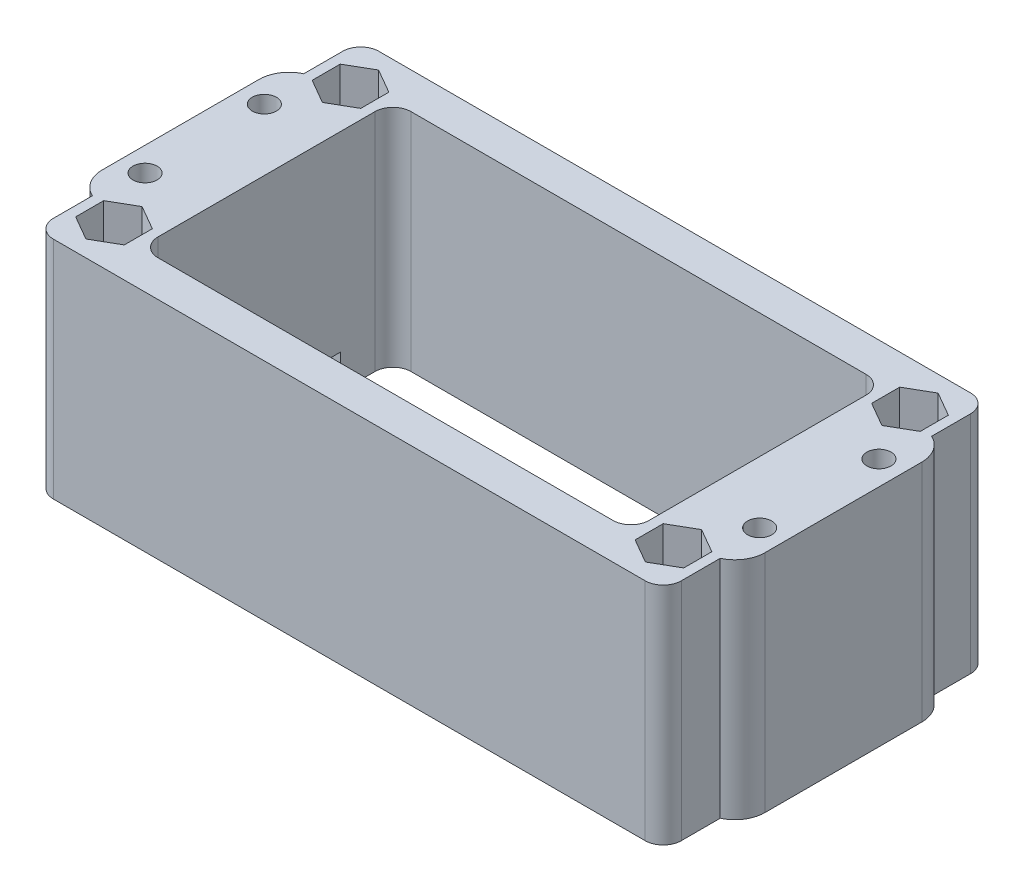
from build123d import *

# Parameters (mm, degrees)
SALIENTE_EXTRUIR1_DEPTH = 18.68
SALIENTE_EXTRUIR2_DEPTH = 18.68
CROQUIS3_W              = 12.25
CROQUIS3_H              = 2.83
CORTAR_EXTRUIR1_DEPTH   = 59.051339796
CROQUIS4_R              = 1.175
CORTAR_EXTRUIR2_DEPTH   = 63.813572819
CORTAR_EXTRUIR3_DEPTH   = 14.68
CROQUIS6_R              = 1
CORTAR_EXTRUIR4_DEPTH   = 5


with BuildPart() as part:
    # Croquis1 → Saliente-Extruir1 (new body)
    with BuildSketch(Plane(origin=(0, 0, 0), x_dir=(1, 0, 0), z_dir=(0, 1, 0))):
        with BuildLine():
            Line((1.5, 0), (50.6, 0))
            ThreePointArc((50.6, 0), (51.660660172, 0.439339828), (52.1, 1.5))
            Line((52.1, 1.5), (52.1, 25.5))
            ThreePointArc((52.1, 25.5), (51.660660172, 26.560660172), (50.6, 27))
            Line((50.6, 27), (1.5, 27))
            ThreePointArc((1.5, 27), (0.439339828, 26.560660172), (0, 25.5))
            Line((0, 25.5), (0, 1.5))
            ThreePointArc((0, 1.5), (0.439339828, 0.439339828), (1.5, 0))
        make_face()
        with BuildLine():
            Line((7.175, 24), (44.925, 24))
            ThreePointArc((44.925, 24), (45.985660172, 23.560660172), (46.425, 22.5))
            Line((46.425, 22.5), (46.425, 4.5))
            ThreePointArc((46.425, 4.5), (45.985660172, 3.439339828), (44.925, 3))
            Line((44.925, 3), (7.175, 3))
            ThreePointArc((7.175, 3), (6.114339828, 3.439339828), (5.675, 4.5))
            Line((5.675, 4.5), (5.675, 22.5))
            ThreePointArc((5.675, 22.5), (6.114339828, 23.560660172), (7.175, 24))
        make_face(mode=Mode.SUBTRACT)
    extrude(amount=SALIENTE_EXTRUIR1_DEPTH)

    # Croquis2 → Saliente-Extruir2 (add)
    with BuildSketch(Plane(origin=(0, 18.68, 0), x_dir=(1, 0, 0), z_dir=(0, 1, 0))):
        with BuildLine():
            Line((0, 22.27), (0, 4.73))
            ThreePointArc((0, 4.73), (-1.056857895, 5.653020288), (-1.45, 7))
            Line((-1.45, 7), (-1.45, 20))
            ThreePointArc((-1.45, 20), (-1.056857895, 21.346979712), (0, 22.27))
        make_face()
        with BuildLine():
            Line((53.55, 20), (53.55, 7))
            ThreePointArc((53.55, 7), (53.156857895, 5.653020288), (52.1, 4.73))
            Line((52.1, 4.73), (52.1, 22.27))
            ThreePointArc((52.1, 22.27), (53.156857895, 21.346979712), (53.55, 20))
        make_face()
    extrude(amount=-SALIENTE_EXTRUIR2_DEPTH)

    # Croquis3 → Cortar-Extruir1 (cut, through all)
    with BuildSketch(Plane(origin=(5.675, 0, 0), x_dir=(0, 0, -1), z_dir=(1, 0, 0))):
        with Locations((13.5, 1.415)):
            Rectangle(CROQUIS3_W, CROQUIS3_H)
    extrude(amount=-CORTAR_EXTRUIR1_DEPTH, mode=Mode.SUBTRACT)

    # Croquis4 → Cortar-Extruir2 (cut, through all)
    with BuildSketch(Plane.XZ):
        with Locations(Location((49.26, -23.3125, 0), (0, 0, 270))):
            Circle(CROQUIS4_R)
        with Locations(Location((2.8375, -23.3125, 0), (0, 0, 270))):
            Circle(CROQUIS4_R)
        with Locations(Location((49.26, -3.69, 0), (0, 0, 270))):
            Circle(CROQUIS4_R)
        with Locations(Location((2.84, -3.69, 0), (0, 0, 270))):
            Circle(CROQUIS4_R)
    extrude(amount=-CORTAR_EXTRUIR2_DEPTH, mode=Mode.SUBTRACT)

    # Croquis5 → Cortar-Extruir3 (cut)
    with BuildSketch(Plane(origin=(0, 18.68, 0), x_dir=(1, 0, 0), z_dir=(0, 1, 0))):
        Polygon((2.8375, 25.6425), (0.819660809, 24.4775), (0.819660809, 22.1475), (2.8375, 20.9825), (4.855339191, 22.1475), (4.855339191, 24.4775), align=None)
        Polygon((47.244660809, 24.4775), (49.2625, 25.6425), (51.280339191, 24.4775), (51.280339191, 22.1475), (49.2625, 20.9825), (47.244660809, 22.1475), align=None)
        Polygon((49.2625, 1.3575), (51.280339191, 2.5225), (51.280339191, 4.8525), (49.2625, 6.0175), (47.244660809, 4.8525), (47.244660809, 2.5225), align=None)
        Polygon((4.855339191, 2.5225), (2.8375, 1.3575), (0.819660809, 2.5225), (0.819660809, 4.8525), (2.8375, 6.0175), (4.855339191, 4.8525), align=None)
    extrude(amount=-CORTAR_EXTRUIR3_DEPTH, mode=Mode.SUBTRACT)

    # Croquis6 → Cortar-Extruir4 (cut)
    with BuildSketch(Plane(origin=(0, 18.68, 0), x_dir=(1, 0, 0), z_dir=(0, 1, 0))):
        with Locations(Location((0.55, 18.45, 0), (0, 0, 270))):
            Circle(CROQUIS6_R)
        with Locations(Location((0.55, 8.55, 0), (0, 0, 270))):
            Circle(CROQUIS6_R)
        with Locations(Location((51.55, 8.55, 0), (0, 0, 90))):
            Circle(CROQUIS6_R)
        with Locations(Location((51.55, 18.45, 0), (0, 0, 90))):
            Circle(CROQUIS6_R)
    extrude(amount=-CORTAR_EXTRUIR4_DEPTH, mode=Mode.SUBTRACT)


solid = part.part
